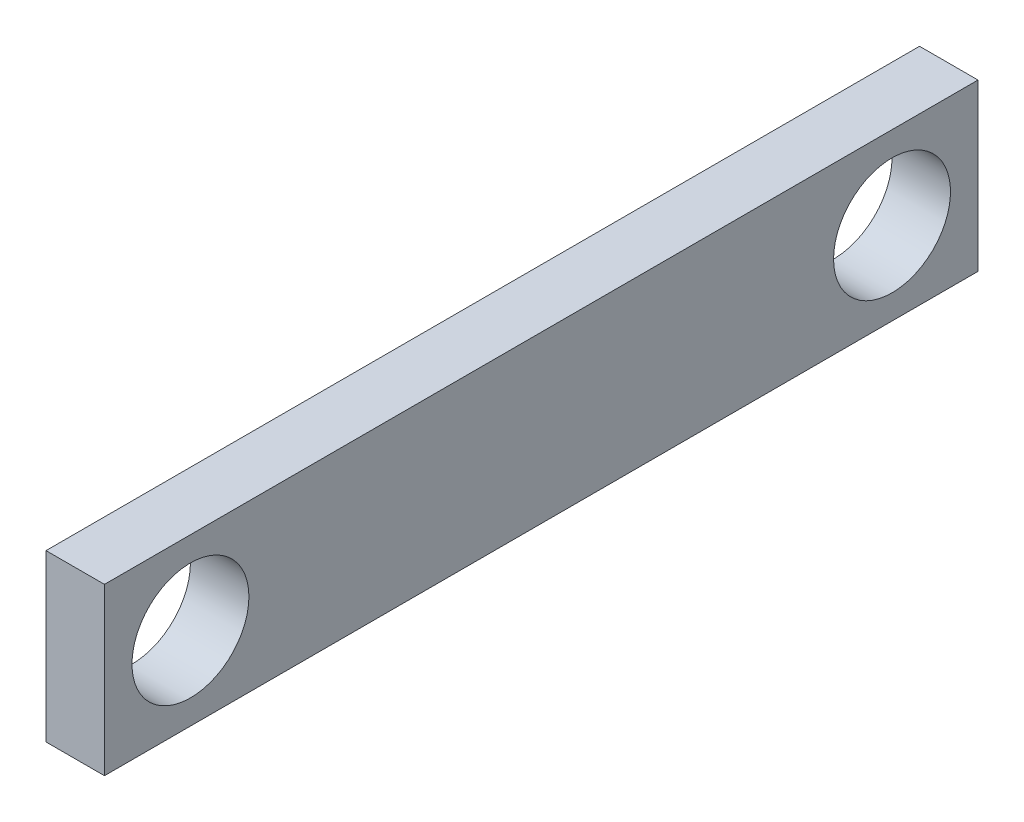
from build123d import *

# Parameters (mm, degrees)
SKETCH1_W           = 29.88277087
SKETCH1_H           = 5.669626998
SKETCH1_R           = 2
BOSS_EXTRUDE1_DEPTH = 2


with BuildPart() as part:
    # Sketch1 → Boss-Extrude1 (new body)
    with BuildSketch(Plane(origin=(0, 0, 0), x_dir=(0, 0, -1), z_dir=(1, 0, 0))):
        Rectangle(SKETCH1_W, SKETCH1_H)
        with Locations((-12, 0)):
            Circle(SKETCH1_R, mode=Mode.SUBTRACT)
        with Locations(Location((12, 0, 0), (0, 0, 180))):
            Circle(SKETCH1_R, mode=Mode.SUBTRACT)
    extrude(amount=BOSS_EXTRUDE1_DEPTH)


solid = part.part
